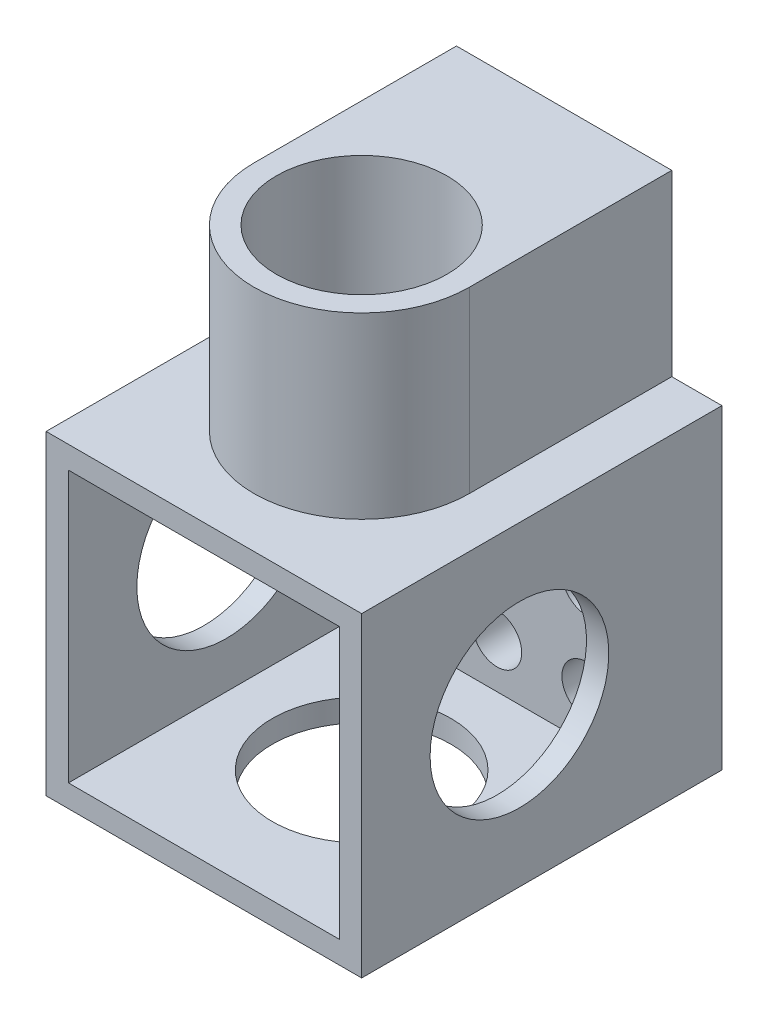
from build123d import *

# Parameters (mm, degrees)
SKETCH1_W           = 44.85
SKETCH1_H           = 44.85
SKETCH1_W_2         = 38.5
SKETCH1_H_2         = 38.5
BOSS_EXTRUDE1_DEPTH = 19.25
SKETCH2_W           = 44.85
SKETCH2_H           = 44.85
BOSS_EXTRUDE2_DEPTH = 3.175
SKETCH3_W           = 44.85
SKETCH3_H           = 44.85
BOSS_EXTRUDE3_DEPTH = 3.175
SKETCH5_R           = 12.7
CUT_EXTRUDE1_DEPTH  = 3.175
CUT_EXTRUDE2_START  = 22.425
SKETCH6_R           = 10
CUT_EXTRUDE2_DEPTH  = 41.675
SKETCH7_R           = 12.7
CUT_EXTRUDE3_DEPTH  = 55.929807482
SKETCH8_W           = 44.85
SKETCH8_H           = 44.85
SKETCH8_R           = 2.2225
BOSS_EXTRUDE4_DEPTH = 6.35
SKETCH9_R           = 3.4925
CUT_EXTRUDE4_DEPTH  = 6.35
CUT_EXTRUDE5_REACH  = 62.226
SKETCH10_W          = 38.5
SKETCH10_H          = 38.5
SKETCH11_R          = 12.1285
BOSS_EXTRUDE5_DEPTH = 25.4


with BuildPart() as part:
    # Sketch1 → Boss-Extrude1 (new, symmetric)
    with BuildSketch(Plane(origin=(0, 0, 0), x_dir=(1, 0, 0), z_dir=(0, 1, 0))):
        Rectangle(SKETCH1_W, SKETCH1_H)
        Rectangle(SKETCH1_W_2, SKETCH1_H_2, mode=Mode.SUBTRACT)
    extrude(amount=BOSS_EXTRUDE1_DEPTH, both=True)

    # Sketch2 → Boss-Extrude2 (add)
    with BuildSketch(Plane(origin=(0, 19.25, 0), x_dir=(1, 0, 0), z_dir=(0, 1, 0))):
        Rectangle(SKETCH2_W, SKETCH2_H)
    extrude(amount=BOSS_EXTRUDE2_DEPTH)

    # Sketch3 → Boss-Extrude3 (add)
    with BuildSketch(Plane.XZ.offset(19.25)):
        Rectangle(SKETCH3_W, SKETCH3_H)
    extrude(amount=BOSS_EXTRUDE3_DEPTH)

    # Sketch5 → Cut-Extrude1 (cut)
    with BuildSketch(Plane(origin=(0, -22.425, -22.425), x_dir=(1, 0, 0), z_dir=(0, 1, 0))):
        with Locations(Location((0, -22.425, 0), (0, 0, 90))):
            Circle(SKETCH5_R)
    extrude(amount=CUT_EXTRUDE1_DEPTH, mode=Mode.SUBTRACT)

    # Sketch6 → Cut-Extrude2 (cut)
    with BuildSketch(Plane(origin=(0, 0, 0), x_dir=(1, 0, 0), z_dir=(0, 1, 0)).offset(CUT_EXTRUDE2_START)):
        with Locations(Location((0, 0, 0), (0, 0, 270))):
            Circle(SKETCH6_R)
    extrude(amount=-CUT_EXTRUDE2_DEPTH, mode=Mode.SUBTRACT)

    # Sketch7 → Cut-Extrude3 (cut, through all)
    with BuildSketch(Plane.ZY.offset(22.425)):
        Circle(SKETCH7_R)
    extrude(amount=-CUT_EXTRUDE3_DEPTH, mode=Mode.SUBTRACT)

    # Sketch8 → Boss-Extrude4 (add)
    with BuildSketch(Plane(origin=(0, 0, -22.425), x_dir=(-1, 0, 0), z_dir=(0, 0, -1))):
        Rectangle(SKETCH8_W, SKETCH8_H)
        with Locations((-12.7, 12.7)):
            Circle(SKETCH8_R, mode=Mode.SUBTRACT)
        with Locations((0, 12.7)):
            Circle(SKETCH8_R, mode=Mode.SUBTRACT)
        with Locations((12.7, 12.7)):
            Circle(SKETCH8_R, mode=Mode.SUBTRACT)
        Circle(SKETCH8_R, mode=Mode.SUBTRACT)
        with Locations((12.7, 0)):
            Circle(SKETCH8_R, mode=Mode.SUBTRACT)
        with Locations((0, -12.7)):
            Circle(SKETCH8_R, mode=Mode.SUBTRACT)
        with Locations((12.7, -12.7)):
            Circle(SKETCH8_R, mode=Mode.SUBTRACT)
        with Locations((-12.7, 0)):
            Circle(SKETCH8_R, mode=Mode.SUBTRACT)
        with Locations((-12.7, -12.7)):
            Circle(SKETCH8_R, mode=Mode.SUBTRACT)
    extrude(amount=BOSS_EXTRUDE4_DEPTH)

    # Sketch9 → Cut-Extrude4 (cut)
    with BuildSketch(Plane.XY.offset(-19.25)):
        with Locations((12.7, 12.7)):
            Circle(SKETCH9_R)
        with Locations((0, 12.7)):
            Circle(SKETCH9_R)
        with Locations((-12.7, 12.7)):
            Circle(SKETCH9_R)
        Circle(SKETCH9_R)
        with Locations((-12.7, 0)):
            Circle(SKETCH9_R)
        with Locations((0, -12.7)):
            Circle(SKETCH9_R)
        with Locations((-12.7, -12.7)):
            Circle(SKETCH9_R)
        with Locations((12.7, 0)):
            Circle(SKETCH9_R)
        with Locations((12.7, -12.7)):
            Circle(SKETCH9_R)
    extrude(amount=-CUT_EXTRUDE4_DEPTH, mode=Mode.SUBTRACT)

    # Sketch10 → Cut-Extrude5 (cut, up to next)
    with BuildSketch(Plane.XY.offset(22.425), mode=Mode.PRIVATE) as cut_extrude5_sk1:
        Rectangle(SKETCH10_W, SKETCH10_H)
    cut_extrude5_tool1 = extrude(cut_extrude5_sk1.sketch, amount=-CUT_EXTRUDE5_REACH, mode=Mode.PRIVATE) & part.part
    add(cut_extrude5_tool1.solids().sort_by_distance((0, 0, 22.425))[0], mode=Mode.SUBTRACT)

    # Sketch11 → Boss-Extrude5 (add)
    with BuildSketch(Plane(origin=(0, 22.425, 0), x_dir=(1, 0, 0), z_dir=(0, 1, 0))):
        with BuildLine():
            Line((-15.3035, 0), (-15.3035, 28.775))
            Line((-15.3035, 28.775), (15.3035, 28.775))
            Line((15.3035, 28.775), (15.3035, 0))
            ThreePointArc((15.3035, 0), (0, -15.3035), (-15.3035, 0))
        make_face()
        with Locations(Location((0, 0, 0), (0, 0, 270))):
            Circle(SKETCH11_R, mode=Mode.SUBTRACT)
    extrude(amount=BOSS_EXTRUDE5_DEPTH)


solid = part.part
